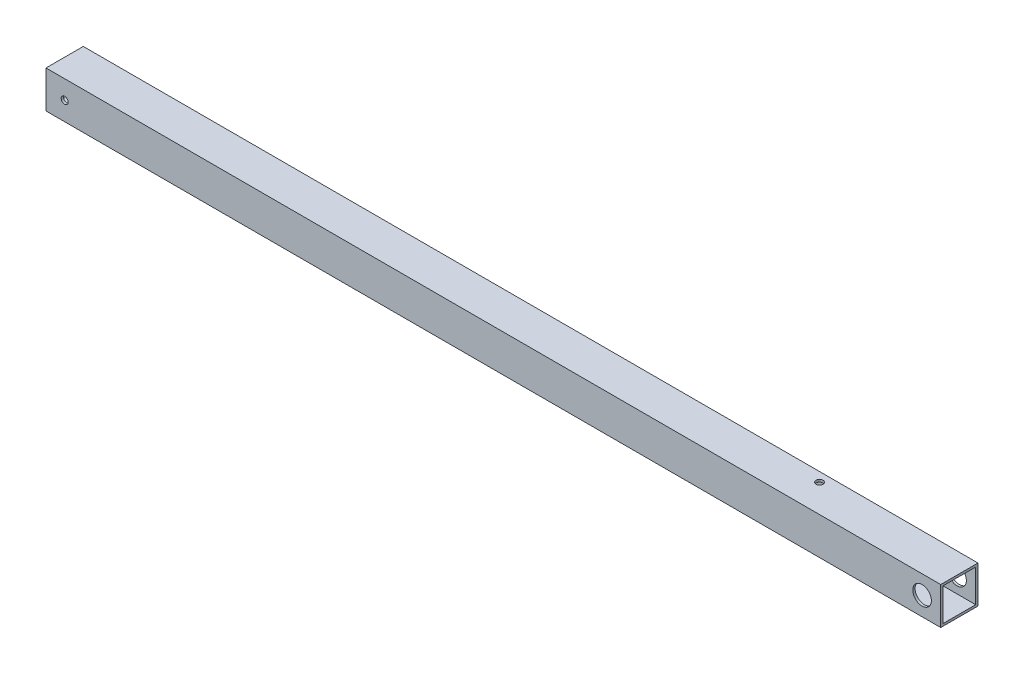
from build123d import *

# Parameters (mm, degrees)
SKETCH1_W                = 609.6
SKETCH1_H                = 25.4
BOSS_EXTRUDE1_DEPTH      = 25.4
SKETCH2_W                = 22.225
SKETCH2_H                = 22.225
CUT_EXTRUDE1_DEPTH       = 611.657416233
HOLE1_D                  = 4.8006
HOLE1_DEPTH              = 1.5875
M4_CLEARANCE_HOLE1_D     = 4.7625
M4_CLEARANCE_HOLE1_DEPTH = 1.5875
HOLE2_D                  = 12.7
HOLE2_DEPTH              = 1.5875
M4_CLEARANCE_HOLE2_D     = 4.7625
M4_CLEARANCE_HOLE2_DEPTH = 25.4
HOLE3_D                  = 12.7
HOLE3_DEPTH              = 25.4
HOLE4_D                  = 4.8006
HOLE4_DEPTH              = 25.4


with BuildPart() as part:
    # Sketch1 → Boss-Extrude1 (new body)
    with BuildSketch(Plane.XY):
        with Locations((304.8, -12.7)):
            Rectangle(SKETCH1_W, SKETCH1_H)
    extrude(amount=-BOSS_EXTRUDE1_DEPTH)

    # Sketch2 → Cut-Extrude1 (cut, through all)
    with BuildSketch(Plane.ZY):
        with Locations((-12.7, -12.7)):
            Rectangle(SKETCH2_W, SKETCH2_H)
    extrude(amount=-CUT_EXTRUDE1_DEPTH, mode=Mode.SUBTRACT)

    # Hole1
    with Locations(Plane(origin=(0, -23.8125, 0), x_dir=(1, 0, 0), z_dir=(0, 1, 0))):
        with Locations((508, 19.05)):
            Hole(HOLE1_D / 2, depth=HOLE1_DEPTH)

    # M4 Clearance Hole1
    with Locations(Plane.XY.offset(-23.8125)):
        with Locations((12.7, -12.7)):
            Hole(M4_CLEARANCE_HOLE1_D / 2, depth=M4_CLEARANCE_HOLE1_DEPTH)

    # Hole2
    with Locations(Plane.XY.offset(-23.8125)):
        with Locations((596.9, -12.7)):
            Hole(HOLE2_D / 2, depth=HOLE2_DEPTH)

    # M4 Clearance Hole2
    with Locations(Plane.XY):
        with Locations((12.7, -12.7)):
            Hole(M4_CLEARANCE_HOLE2_D / 2, depth=M4_CLEARANCE_HOLE2_DEPTH)

    # Hole3
    with Locations(Plane.XY):
        with Locations((596.9, -12.7)):
            Hole(HOLE3_D / 2, depth=HOLE3_DEPTH)

    # Hole4
    with Locations(Plane(origin=(0, 0, 0), x_dir=(1, 0, 0), z_dir=(0, 1, 0))):
        with Locations((508, 19.05)):
            Hole(HOLE4_D / 2, depth=HOLE4_DEPTH)


solid = part.part
